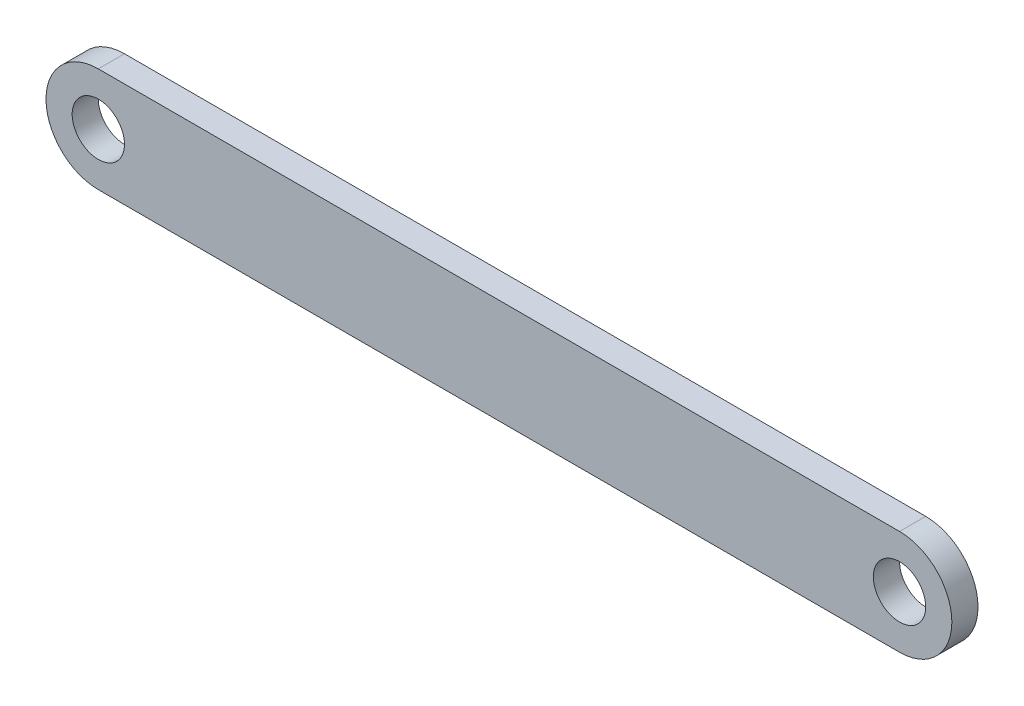
from build123d import *

# Parameters (mm, degrees)
ESBO_O1_R                = 1
RESSALTO_EXTRUS_O1_DEPTH = 1


with BuildPart() as part:
    # Esboço1 → Ressalto-extrusão1 (new body)
    with BuildSketch(Plane.XY):
        with BuildLine():
            Line((-15.315, 2), (15.315, 2))
            ThreePointArc((15.315, 2), (17.315, 0), (15.315, -2))
            Line((15.315, -2), (-15.315, -2))
            ThreePointArc((-15.315, -2), (-17.315, 0), (-15.315, 2))
        make_face()
        with Locations((-15.315, 0)):
            Circle(ESBO_O1_R, mode=Mode.SUBTRACT)
        with Locations((15.315, 0)):
            Circle(ESBO_O1_R, mode=Mode.SUBTRACT)
    extrude(amount=RESSALTO_EXTRUS_O1_DEPTH)


solid = part.part
